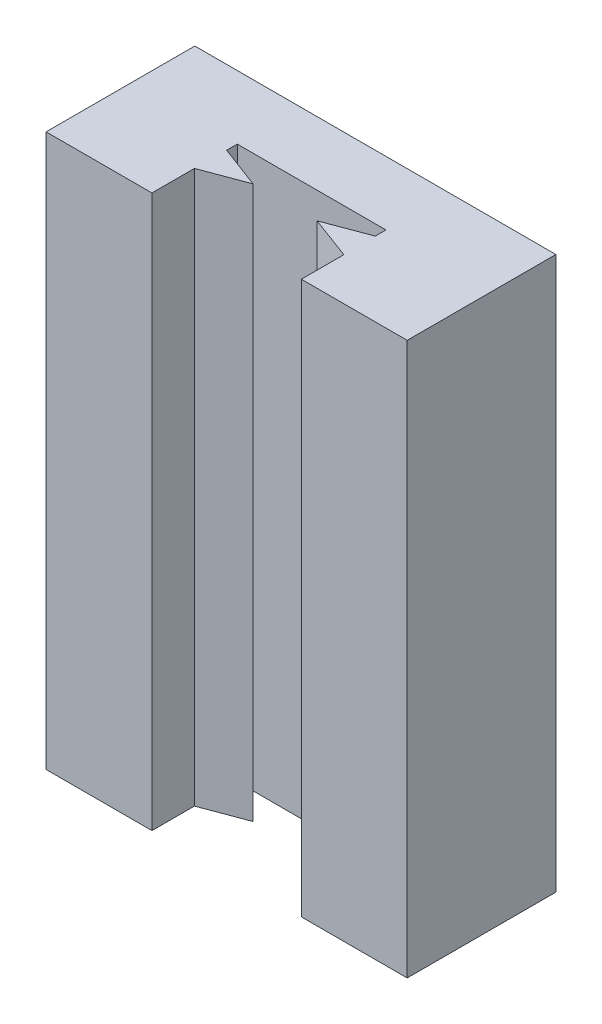
from build123d import *

# Parameters (mm, degrees)
EXTRUDE_1_DEPTH     = 26
SKETCH_2_R          = 1
CUT_EXTRUDE_1_DEPTH = 3


with BuildPart() as part:
    # 草图1 → 凸台-拉伸1 (new body)
    with BuildSketch(Plane(origin=(0, 0, 0), x_dir=(1, 0, 0), z_dir=(0, 1, 0))):
        Polygon((-8.5, 0), (8.5, 0), (8.5, -7), (3.517553147, -7), (3.517553147, -5), (1.508639639, -4.25), (3.5, -3.5), (3.5, -3), (-3.5, -3), (-3.5, -3.5), (-1.508639639, -4.25), (-3.517553147, -5), (-3.517553147, -7), (-8.5, -7), align=None)
    extrude(amount=EXTRUDE_1_DEPTH)

    # 草图2 → 切除-拉伸1 (cut)
    with BuildSketch(Plane(origin=(0, 0, 0), x_dir=(-1, 0, 0), z_dir=(0, 0, -1))):
        with Locations((6, 19.5)):
            Circle(SKETCH_2_R)
        with Locations((6, 6.5)):
            Circle(SKETCH_2_R)
        with Locations(Location((-6, 6.5, 0), (0, 0, 180))):
            Circle(SKETCH_2_R)
        with Locations(Location((-6, 19.5, 0), (0, 0, 180))):
            Circle(SKETCH_2_R)
    extrude(amount=-CUT_EXTRUDE_1_DEPTH, mode=Mode.SUBTRACT)


solid = part.part
